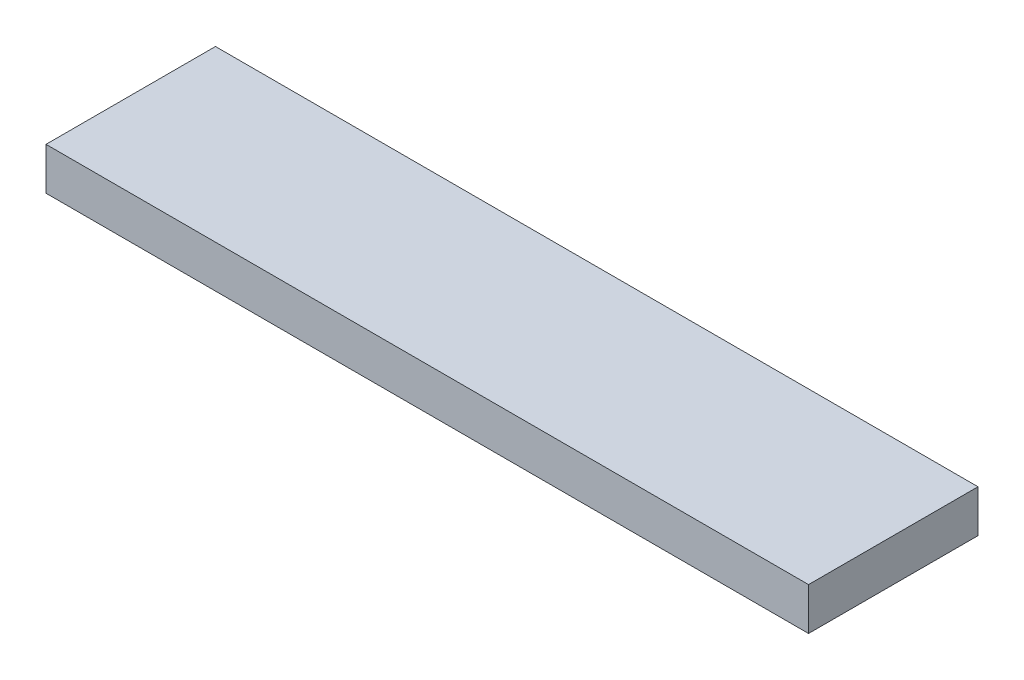
from build123d import *

# Parameters (mm, degrees)
SKETCH_1_W      = 18
SKETCH_1_H      = 4
EXTRUDE_1_DEPTH = 1


with BuildPart() as part:
    # 草图1 → 凸台-拉伸1 (new body)
    with BuildSketch(Plane(origin=(0, 0, 0), x_dir=(1, 0, 0), z_dir=(0, 1, 0))):
        with Locations((9, 2)):
            Rectangle(SKETCH_1_W, SKETCH_1_H)
    extrude(amount=EXTRUDE_1_DEPTH)


solid = part.part
